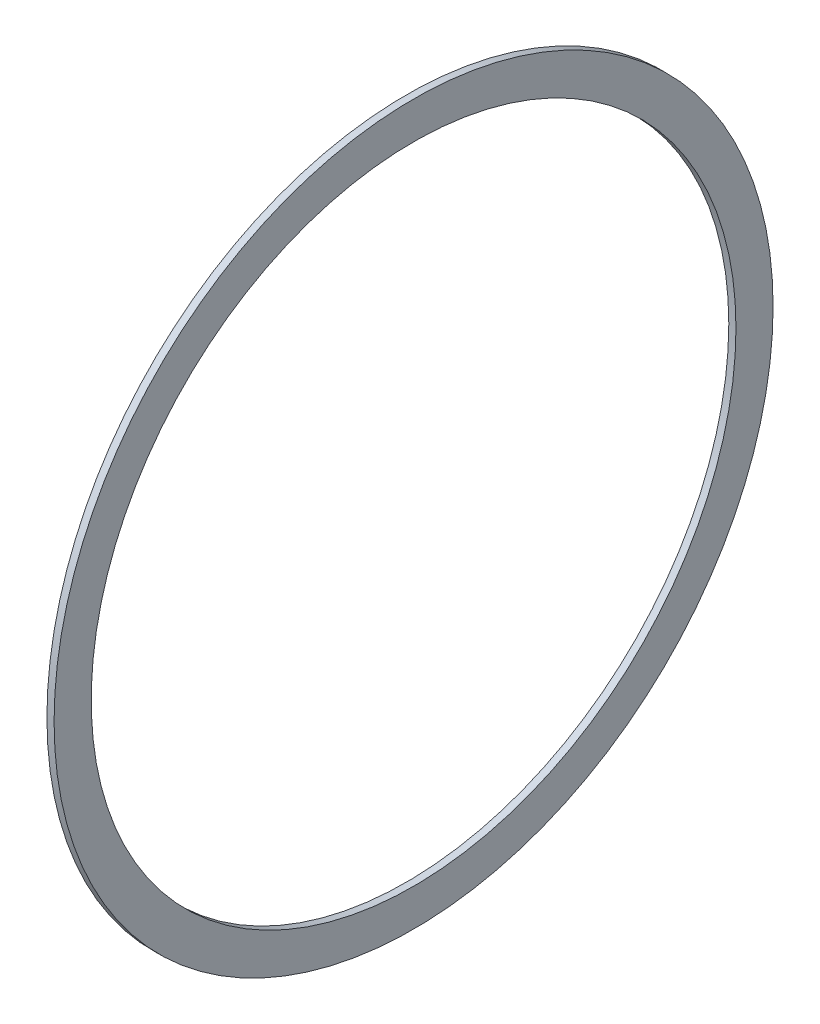
from build123d import *

# Parameters (mm, degrees)
SKETCH1_R           = 76.2
SKETCH1_R_2         = 68.33108
BOSS_EXTRUDE1_DEPTH = 1.51892


with BuildPart() as part:
    # Sketch1 → Boss-Extrude1 (new body)
    with BuildSketch(Plane(origin=(0, 0, 0), x_dir=(0, 0, -1), z_dir=(1, 0, 0))):
        Circle(SKETCH1_R)
        Circle(SKETCH1_R_2, mode=Mode.SUBTRACT)
    extrude(amount=BOSS_EXTRUDE1_DEPTH)


solid = part.part
